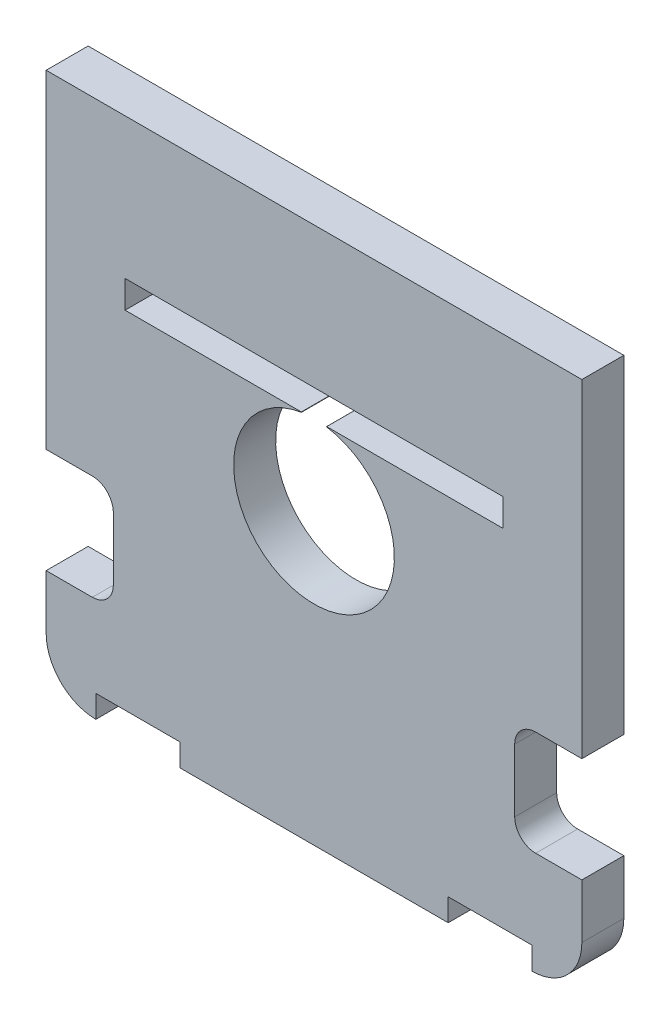
from build123d import *

# Parameters (mm, degrees)
BOSS_EXTRUDE1_DEPTH = 6.35


with BuildPart() as part:
    # Sketch2 → Boss-Extrude1 (new body)
    with BuildSketch(Plane.XY):
        with BuildLine():
            Line((8821.223823253, 3058.445977911), (8821.223823253, 3008.779305873))
            Line((8821.223823253, 3008.779305873), (8814.238823253, 3008.779305873))
            ThreePointArc((8814.238823253, 3008.779305873), (8811.993759223, 3007.849369904), (8811.063823253, 3005.604305873))
            Line((8811.063823253, 3005.604305873), (8811.063823253, 2996.079305873))
            ThreePointArc((8811.063823253, 2996.079305873), (8811.993759223, 2993.834241843), (8814.238823253, 2992.904305873))
            Line((8814.238823253, 2992.904305873), (8821.223823253, 2992.904305873))
            Line((8821.223823253, 2992.904305873), (8821.223823253, 2984.700105873))
            ThreePointArc((8821.223823253, 2984.700105873), (8819.021734877, 2979.38379425), (8813.705423253, 2977.181705873))
            Line((8813.705423253, 2977.181705873), (8813.705423253, 2980.585305873))
            Line((8813.705423253, 2980.585305873), (8801.005423253, 2980.585305873))
            Line((8801.005423253, 2980.585305873), (8801.005423253, 2977.181705873))
            Line((8801.005423253, 2977.181705873), (8760.416223253, 2977.181705873))
            Line((8760.416223253, 2977.181705873), (8760.416223253, 2980.585305873))
            Line((8760.416223253, 2980.585305873), (8747.716223253, 2980.585305873))
            Line((8747.716223253, 2980.585305873), (8747.716223253, 2977.181705873))
            ThreePointArc((8747.716223253, 2977.181705873), (8742.399911629, 2979.38379425), (8740.197823253, 2984.700105873))
            Line((8740.197823253, 2984.700105873), (8740.197823253, 2992.904305873))
            Line((8740.197823253, 2992.904305873), (8747.182823253, 2992.904305873))
            ThreePointArc((8747.182823253, 2992.904305873), (8749.427887283, 2993.834241843), (8750.357823253, 2996.079305873))
            Line((8750.357823253, 2996.079305873), (8750.357823253, 3005.604305873))
            ThreePointArc((8750.357823253, 3005.604305873), (8749.427887283, 3007.849369904), (8747.182823253, 3008.779305873))
            Line((8747.182823253, 3008.779305873), (8740.197823253, 3008.779305873))
            Line((8740.197823253, 3008.779305873), (8740.197823253, 3058.445977911))
            Line((8740.197823253, 3058.445977911), (8821.223823253, 3058.445977911))
        make_face()
        with BuildLine():
            Line((8809.285823253, 3037.151105873), (8809.285823253, 3032.985505873))
            Line((8809.285823253, 3032.985505873), (8782.631506696, 3032.985505873))
            ThreePointArc((8782.631506696, 3032.985505873), (8782.606186279, 3032.962114966), (8782.6275011, 3032.935023704))
            ThreePointArc((8782.6275011, 3032.935023704), (8780.710823253, 3008.779305873), (8778.794145406, 3032.935023704))
            ThreePointArc((8778.794145406, 3032.935023704), (8778.81546023, 3032.962114966), (8778.79013981, 3032.985505873))
            Line((8778.79013981, 3032.985505873), (8752.135823253, 3032.985505873))
            Line((8752.135823253, 3032.985505873), (8752.135823253, 3037.151105873))
            Line((8752.135823253, 3037.151105873), (8809.285823253, 3037.151105873))
        make_face(mode=Mode.SUBTRACT)
    extrude(amount=BOSS_EXTRUDE1_DEPTH)


solid = part.part
